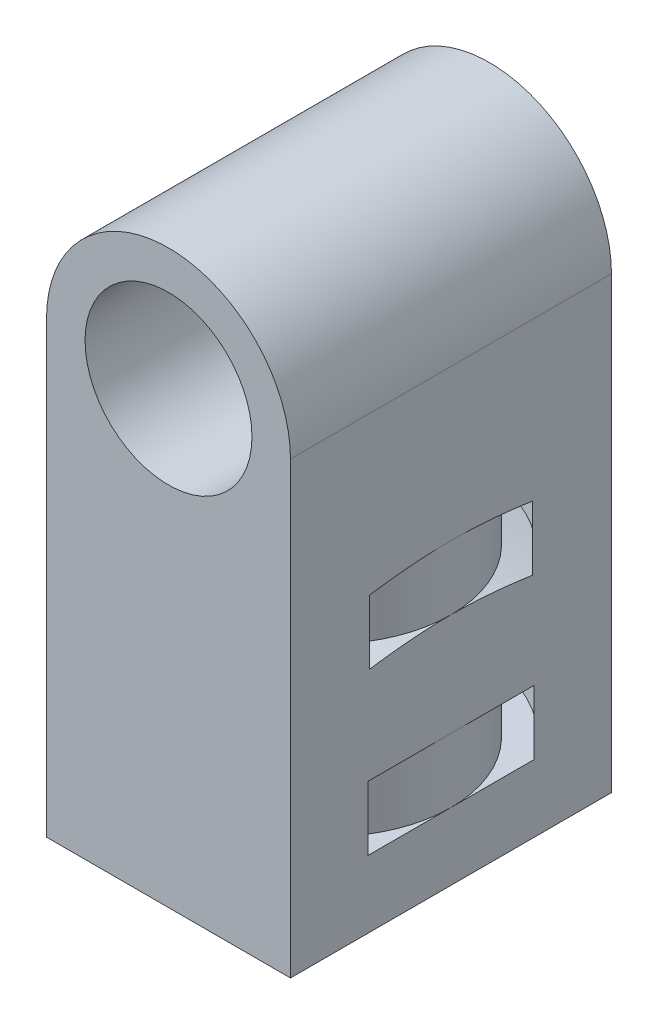
from build123d import *

# Parameters (mm, degrees)
CROQUIS1_R              = 6.5
SALIENTE_EXTRUIR1_DEPTH = 12.5
CROQUIS3_W              = 19
CROQUIS3_H              = 25
CROQUIS3_R              = 6.5
SALIENTE_EXTRUIR2_DEPTH = 25
CROQUIS8_W              = 2
CROQUIS8_H              = 5


with BuildPart() as part:
    # Croquis1 → Saliente-Extruir1 (new, symmetric)
    with BuildSketch(Plane.XY):
        with BuildLine():
            Line((-9.5, -10), (9.5, -10))
            Line((9.5, -10), (9.5, 0))
            ThreePointArc((9.5, 0), (0, 9.5), (-9.5, 0))
            Line((-9.5, 0), (-9.5, -10))
        make_face()
        Circle(CROQUIS1_R, mode=Mode.SUBTRACT)
    extrude(amount=SALIENTE_EXTRUIR1_DEPTH, both=True)

    # Croquis3 → Saliente-Extruir2 (add)
    with BuildSketch(Plane(origin=(0, -10, 0), x_dir=(-1, 0, 0), z_dir=(0, -1, 0))):
        Rectangle(CROQUIS3_W, CROQUIS3_H)
        with Locations(Location((0, 0, 0), (0, 0, 90))):
            Circle(CROQUIS3_R, mode=Mode.SUBTRACT)
    extrude(amount=SALIENTE_EXTRUIR2_DEPTH)

    # Croquis8 → Cortar-Revolución1 (revolve, cut)
    with BuildSketch(Plane.XY):
        Polygon((-11.434596491, -17.257283371), (-11.434596491, -12.257283371), (-9.5, -11.75), (-9.5, -16.75), align=None)
        with Locations((-10.5, -27.25)):
            Rectangle(CROQUIS8_W, CROQUIS8_H)
    revolve(axis=Axis((0, -6.5, 0), (0, -1, 0)), mode=Mode.SUBTRACT)


solid = part.part
